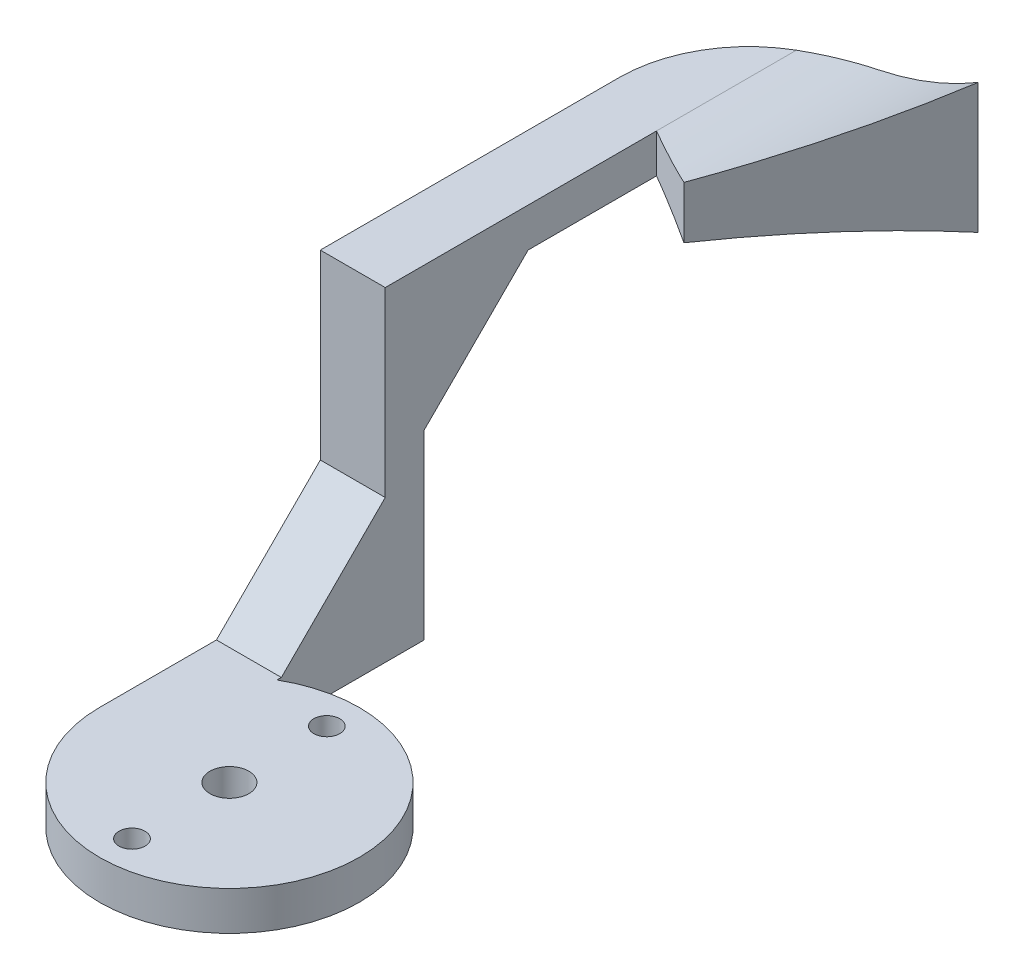
from build123d import *

# Parameters (mm, degrees)
SKETCH1_R           = 1.5
BOSS_EXTRUDE1_DEPTH = 3
SKETCH2_W           = 1.5
SKETCH2_H           = 3
BOSS_EXTRUDE2_DEPTH = 5
BOSS_EXTRUDE3_DEPTH = 3
BOSS_EXTRUDE4_START = -1.5
BOSS_EXTRUDE4_DEPTH = 5
SKETCH6_OUTSIDE_W   = 35.874
SKETCH6_OUTSIDE_H   = 44.374
CUT_EXTRUDE2_DEPTH  = 55.196402095
SKETCH7_R           = 1
CUT_EXTRUDE3_DEPTH  = 59.414467538


with BuildPart() as part:
    # Sketch1 → Boss-Extrude1 (new body)
    with BuildSketch(Plane(origin=(0, 0, 0), x_dir=(1, 0, 0), z_dir=(0, 1, 0))):
        with BuildLine():
            Line((-10, 0), (-10, 20))
            Line((-10, 20), (-5, 20))
            Line((-5, 20), (-5, 8.660254038))
            ThreePointArc((-5, 8.660254038), (8.660254038, -5), (-10, 0))
        make_face()
        with Locations(Location((0, 0, 0), (0, 0, 270))):
            Circle(SKETCH1_R, mode=Mode.SUBTRACT)
    extrude(amount=BOSS_EXTRUDE1_DEPTH)

    # Sketch2 → Boss-Extrude2 (add)
    with BuildSketch(Plane.ZY.offset(10)):
        with Locations((-19.25, 1.5)):
            Rectangle(SKETCH2_W, SKETCH2_H)
        Polygon((-18.5, 0), (-17, 0), (-9, 0), (-9, 3), (-18.5, 3), align=None)
        Polygon((-18.5, 25), (-18.5, 3), (-9, 3), (-17, 11), (-17, 25), align=None)
        Polygon((-20, 3), (-18.5, 3), (-18.5, 25), (-20, 25), (-30, 25), (-30, 22), (-28, 22), (-20, 14), align=None)
    extrude(amount=-BOSS_EXTRUDE2_DEPTH)

    # Sketch4 → Boss-Extrude3 (add)
    with BuildSketch(Plane(origin=(0, 25, 0), x_dir=(1, 0, 0), z_dir=(0, 1, 0))):
        with BuildLine():
            Line((-5, 17), (-10, 17))
            Line((-10, 17), (-10, 40))
            ThreePointArc((-10, 40), (-7.071067812, 47.071067812), (0, 50))
            Line((0, 50), (0, 35))
            Line((0, 35), (-5, 37.886751346))
            Line((-5, 37.886751346), (-5, 30))
            Line((-5, 30), (-5, 17))
        make_face()
    extrude(amount=-BOSS_EXTRUDE3_DEPTH)

    # Sketch5 → Boss-Extrude4 (add, symmetric)
    with BuildSketch(Plane(origin=(0, 25, 0), x_dir=(1, 0, 0), z_dir=(0, 1, 0)).offset(BOSS_EXTRUDE4_START)):
        with BuildLine():
            Line((-5, 37.886751346), (-10, 37.886751346))
            Line((-10, 37.886751346), (-10, 40))
            ThreePointArc((-10, 40), (-7.071067812, 47.071067812), (0, 50))
            Line((0, 50), (7.642881742, 50))
            Line((7.642881742, 50), (0, 35))
            Line((0, 35), (-5, 37.886751346))
        make_face()
    extrude(amount=BOSS_EXTRUDE4_DEPTH, both=True)

    # Sketch6 outside → Cut-Extrude2 (cut, through all)
    with BuildSketch(Plane.XY.offset(-35)):
        with Locations((0, 14.25)):
            Rectangle(SKETCH6_OUTSIDE_W, SKETCH6_OUTSIDE_H)
        with BuildLine():
            Line((-10, 25), (-5, 25))
            ThreePointArc((-5, 25), (1.559200766, 25.891151362), (7.642881742, 28.5))
            Line((7.642881742, 28.5), (7.642881742, 18.5))
            ThreePointArc((7.642881742, 18.5), (1.559200766, 21.108848638), (-5, 22))
            Line((-5, 22), (-10, 22))
            Line((-10, 22), (-10, 25))
        make_face(mode=Mode.SUBTRACT)
    extrude(amount=-CUT_EXTRUDE2_DEPTH, mode=Mode.SUBTRACT)

    # Sketch7 → Cut-Extrude3 (cut, through all)
    with BuildSketch(Plane.XZ):
        with Locations(Location((0, -7.5, 0), (0, 0, 270))):
            Circle(SKETCH7_R)
        with Locations(Location((0, 7.5, 0), (0, 0, 270))):
            Circle(SKETCH7_R)
    extrude(amount=-CUT_EXTRUDE3_DEPTH, mode=Mode.SUBTRACT)


solid = part.part
